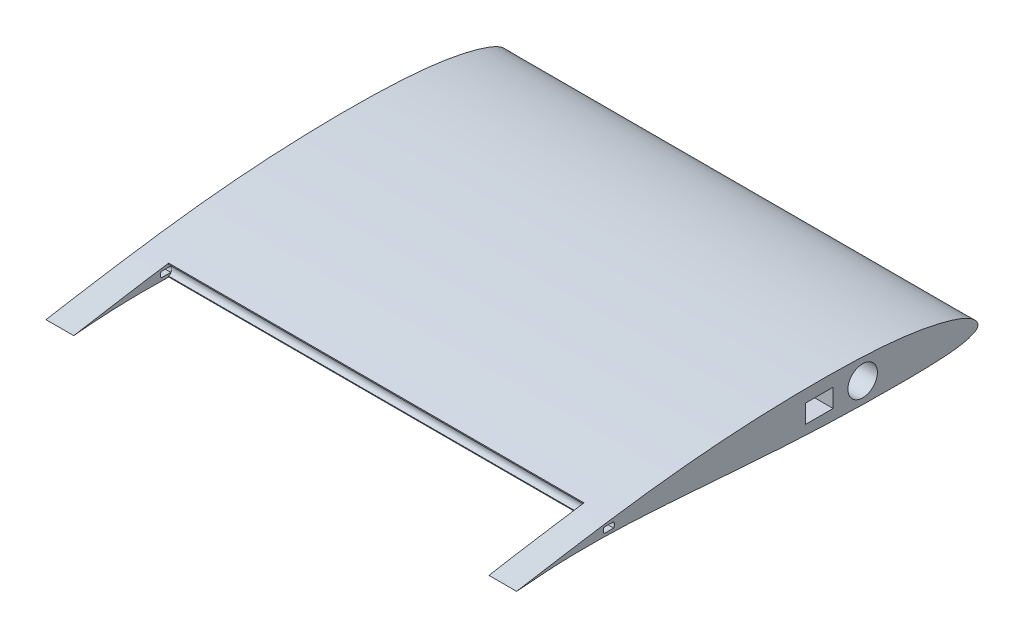
from build123d import *

# Parameters (mm, degrees)
SCHIZZO1_R               = 8
SCHIZZO1_W               = 15
SCHIZZO1_H               = 10
CORPOFOAM_DEPTH          = 225
SCHIZZO2_W               = 5
SCHIZZO2_H               = 6.542892791
SMUSSOPOSTERIORE_DEPTH   = 302.510060719
SCHIZZO3_R               = 8
SCHIZZO3_W               = 15
SCHIZZO3_H               = 10
LATODESTRO_DEPTH         = 15
LATOSINISTRO_START       = 15
SCHIZZO4_R               = 8
SCHIZZO4_W               = 15
SCHIZZO4_H               = 10
LATOSINISTRO_DEPTH       = 15
FOROPERNOALETTONE_DEPTH  = 358.502890584
FOROFOAMLONGHERONE_START = -255
FOROFOAMLONGHERONE_DEPTH = 15


with BuildPart() as part:
    # Schizzo1 → CorpoFoam (new body)
    with BuildSketch(Plane(origin=(0, 0, 0), x_dir=(0, 0, -1), z_dir=(1, 0, 0))):
        with BuildLine():
            ThreePointArc((-200, 8.059305289), (-196.8581753, 4.91748059), (-200, 1.77565589))
            add(Edge.make_bspline(
                [(-200, 1.77565589), (-196.241450344, 1.678792644), (-188.275993902, 1.377404844), (-175.953687417, 0.706014078), (-162.931424918, -0.160208642), (-149.615771744, -1.148016327), (-136.176354995, -2.19092491), (-122.767140548, -3.219583979), (-109.520053587, -4.152743127), (-96.546095975, -4.938564365), (-83.940819302, -5.536830703), (-71.801839291, -5.947648205), (-60.245256003, -6.218450939), (-49.398732891, -6.355369756), (-39.397226194, -6.381387963), (-30.361934842, -6.26504923), (-22.412181103, -6.012164917), (-15.626227231, -5.597433901), (-10.071907511, -4.928706579), (-5.697692612, -4.040446981), (-2.625320639, -2.865752984), (-0.494884225, -1.71152847), (0.021312549, -0.410454231), (-0.0311692, 0.792659827), (-0.812599242, 2.305684337), (-2.728863517, 4.238352424), (-5.769907241, 6.118172121), (-9.880942804, 7.913594202), (-15.074930468, 9.641318178), (-21.298752222, 11.283896488), (-28.49717212, 12.788381759), (-36.607373406, 14.097834908), (-45.57302844, 15.159429017), (-55.332910074, 15.960903998), (-65.816536498, 16.494069738), (-76.93137626, 16.791989705), (-88.566949028, 16.864754131), (-100.596999886, 16.726715291), (-112.888825982, 16.383385064), (-125.311615819, 15.825573667), (-137.743791097, 15.05233187), (-150.072384382, 14.059339074), (-162.191375056, 12.881586986), (-173.989074322, 11.549280346), (-185.352364446, 10.116249729), (-193.973044007, 8.932981988), (-198.793601378, 8.235543811), (-200, 8.059305289)],
                knots=[0.098689812, 0.098689812, 0.098689812, 0.098689812, 0.120926258, 0.145825281, 0.171670912, 0.198108537, 0.224790184, 0.25139058, 0.277643491, 0.30332675, 0.328257458, 0.352272548, 0.375156062, 0.396620664, 0.416422729, 0.43430442, 0.45005468, 0.463465465, 0.474478994, 0.483169222, 0.489678354, 0.494104066, 0.496910015, 0.497289785, 0.501214273, 0.50645795, 0.513356957, 0.522168632, 0.53296597, 0.545689209, 0.560220779, 0.576438923, 0.594258689, 0.613600245, 0.634342386, 0.656331109, 0.679351894, 0.703152303, 0.727478208, 0.752070739, 0.776691164, 0.801140184, 0.825214387, 0.848697424, 0.871352858, 0.892947449, 0.90015767, 0.90015767, 0.90015767, 0.90015767], degree=3))
        make_face()
        with Locations((-62.499919709, 5.077309939)):
            Circle(SCHIZZO1_R, mode=Mode.SUBTRACT)
        with Locations((-85.999919709, 5.077309939)):
            Rectangle(SCHIZZO1_W, SCHIZZO1_H, mode=Mode.SUBTRACT)
    extrude(amount=CORPOFOAM_DEPTH)

    # Schizzo2 → SmussoPosteriore (cut, through all)
    with BuildSketch(Plane(origin=(225, 0, 0), x_dir=(0, 0, -1), z_dir=(1, 0, 0))):
        with Locations((-201, 5.006075261)):
            Rectangle(SCHIZZO2_W, SCHIZZO2_H)
    extrude(amount=-SMUSSOPOSTERIORE_DEPTH, mode=Mode.SUBTRACT)

    # Schizzo3 → LatoDestro (add)
    with BuildSketch(Plane(origin=(225, 0, 0), x_dir=(0, 0, -1), z_dir=(1, 0, 0))):
        with BuildLine():
            add(Edge.make_bspline(
                [(-250, 0), (-250.000228294, -0.008042796), (-248.284955516, 0.172375658), (-246.518112419, 0.308690015), (-242.189387343, 0.685693594), (-236.806461263, 1.074101529), (-229.680385952, 1.49731724), (-221.184158698, 1.823218603), (-211.337618208, 1.967626101), (-200.371188527, 1.833221056), (-188.499913622, 1.38960529), (-175.953687417, 0.706014078), (-162.931424918, -0.160208642), (-149.615771744, -1.148016327), (-136.176354995, -2.19092491), (-122.767140548, -3.219583979), (-109.520053587, -4.152743127), (-96.546095975, -4.938564365), (-83.940819302, -5.536830703), (-71.801839291, -5.947648205), (-60.245256003, -6.218450939), (-49.398732891, -6.355369756), (-39.397226194, -6.381387963), (-30.361934842, -6.26504923), (-22.412181103, -6.012164917), (-15.626227231, -5.597433901), (-10.071907511, -4.928706579), (-5.697692612, -4.040446981), (-2.625320639, -2.865752984), (-0.494884225, -1.71152847), (0.021312549, -0.410454231), (-0.0311692, 0.792659827), (-0.812599242, 2.305684337), (-2.728863517, 4.238352424), (-5.769907241, 6.118172121), (-9.880942804, 7.913594202), (-15.074930468, 9.641318178), (-21.298752222, 11.283896488), (-28.49717212, 12.788381759), (-36.607373406, 14.097834908), (-45.57302844, 15.159429017), (-55.332910074, 15.960903998), (-65.816536498, 16.494069738), (-76.93137626, 16.791989705), (-88.566949028, 16.864754131), (-100.596999886, 16.726715291), (-112.888825982, 16.383385064), (-125.311615819, 15.825573667), (-137.743791097, 15.05233187), (-150.072384382, 14.059339074), (-162.191375056, 12.881586986), (-173.989074322, 11.549280346), (-185.352364446, 10.116249729), (-196.163081698, 8.632379125), (-206.300441402, 7.131513884), (-215.560350587, 5.731221768), (-223.977157043, 4.293295127), (-231.363413336, 3.181808874), (-237.746440904, 2.098942417), (-242.622069366, 1.245861917), (-246.644529332, 0.552864946), (-248.32839844, 0.246216765), (-249.999773563, 0.007977377), (-250, 0)],
                knots=[0, 0, 0, 0, 0.001588889, 0.006329218, 0.014202456, 0.025172808, 0.039173483, 0.056060631, 0.075578924, 0.097363607, 0.120926258, 0.145825281, 0.171670912, 0.198108537, 0.224790184, 0.25139058, 0.277643491, 0.30332675, 0.328257458, 0.352272548, 0.375156062, 0.396620664, 0.416422729, 0.43430442, 0.45005468, 0.463465465, 0.474478994, 0.483169222, 0.489678354, 0.494104066, 0.496910015, 0.497289785, 0.501214273, 0.50645795, 0.513356957, 0.522168632, 0.53296597, 0.545689209, 0.560220779, 0.576438923, 0.594258689, 0.613600245, 0.634342386, 0.656331109, 0.679351894, 0.703152303, 0.727478208, 0.752070739, 0.776691164, 0.801140184, 0.825214387, 0.848697424, 0.871352858, 0.892947449, 0.913230871, 0.931955467, 0.948342069, 0.963693004, 0.976235918, 0.986320059, 0.993788799, 0.998424035, 1, 1, 1, 1], degree=3))
        make_face()
        with Locations((-62.499919709, 5.077309939)):
            Circle(SCHIZZO3_R, mode=Mode.SUBTRACT)
        with Locations((-85.999919709, 5.077309939)):
            Rectangle(SCHIZZO3_W, SCHIZZO3_H, mode=Mode.SUBTRACT)
    extrude(amount=LATODESTRO_DEPTH)

    # Schizzo4 → LatoSinistro (add)
    with BuildSketch(Plane.ZY.offset(LATOSINISTRO_START)):
        with BuildLine():
            add(Edge.make_bspline(
                [(250, 0), (249.999773563, 0.007977377), (248.32839844, 0.246216765), (246.644529332, 0.552864946), (242.622069366, 1.245861917), (237.746440904, 2.098942417), (231.363413336, 3.181808874), (223.977157043, 4.293295127), (215.560350587, 5.731221768), (206.300441402, 7.131513884), (196.163081698, 8.632379125), (185.352364446, 10.116249729), (173.989074322, 11.549280346), (162.191375056, 12.881586986), (150.072384382, 14.059339074), (137.743791097, 15.05233187), (125.311615819, 15.825573667), (112.888825982, 16.383385064), (100.596999886, 16.726715291), (88.566949028, 16.864754131), (76.93137626, 16.791989705), (65.816536498, 16.494069738), (55.332910074, 15.960903998), (45.57302844, 15.159429017), (36.607373406, 14.097834908), (28.49717212, 12.788381759), (21.298752222, 11.283896488), (15.074930468, 9.641318178), (9.880942804, 7.913594202), (5.769907241, 6.118172121), (2.728863517, 4.238352424), (0.812599242, 2.305684337), (0.0311692, 0.792659827), (-0.021312549, -0.410454231), (0.494884225, -1.71152847), (2.625320639, -2.865752984), (5.697692612, -4.040446981), (10.071907511, -4.928706579), (15.626227231, -5.597433901), (22.412181103, -6.012164917), (30.361934842, -6.26504923), (39.397226194, -6.381387963), (49.398732891, -6.355369756), (60.245256003, -6.218450939), (71.801839291, -5.947648205), (83.940819302, -5.536830703), (96.546095975, -4.938564365), (109.520053587, -4.152743127), (122.767140548, -3.219583979), (136.176354995, -2.19092491), (149.615771744, -1.148016327), (162.931424918, -0.160208642), (175.953687417, 0.706014078), (188.499913622, 1.38960529), (200.371188527, 1.833221056), (211.337618208, 1.967626101), (221.184158698, 1.823218603), (229.680385952, 1.49731724), (236.806461263, 1.074101529), (242.189387343, 0.685693594), (246.518112419, 0.308690015), (248.284955516, 0.172375658), (250.000228294, -0.008042796), (250, 0)],
                knots=[0, 0, 0, 0, 0.001575965, 0.006211201, 0.013679941, 0.023764082, 0.036306996, 0.051657931, 0.068044533, 0.086769129, 0.107052551, 0.128647142, 0.151302576, 0.174785613, 0.198859816, 0.223308836, 0.247929261, 0.272521792, 0.296847697, 0.320648106, 0.343668891, 0.365657614, 0.386399755, 0.405741311, 0.423561077, 0.439779221, 0.454310791, 0.46703403, 0.477831368, 0.486643043, 0.49354205, 0.498785727, 0.502710215, 0.503089985, 0.505895934, 0.510321646, 0.516830778, 0.525521006, 0.536534535, 0.54994532, 0.56569558, 0.583577271, 0.603379336, 0.624843938, 0.647727452, 0.671742542, 0.69667325, 0.722356509, 0.74860942, 0.775209816, 0.801891463, 0.828329088, 0.854174719, 0.879073742, 0.902636393, 0.924421076, 0.943939369, 0.960826517, 0.974827192, 0.985797544, 0.993670782, 0.998411111, 1, 1, 1, 1], degree=3))
        make_face()
        with Locations((62.499919709, 5.077309939)):
            Circle(SCHIZZO4_R, mode=Mode.SUBTRACT)
        with Locations((85.999919709, 5.077309939)):
            Rectangle(SCHIZZO4_W, SCHIZZO4_H, mode=Mode.SUBTRACT)
    extrude(amount=-LATOSINISTRO_DEPTH)

    # Schizzo5 → ForoPernoAlettone (cut, through all)
    with BuildSketch(Plane.ZY.offset(15)):
        with BuildLine():
            Line((197.401923789, 6.41748059), (202.598076211, 6.41748059))
            ThreePointArc((202.598076211, 6.41748059), (203, 4.91748059), (202.598076211, 3.41748059))
            Line((202.598076211, 3.41748059), (197.401923789, 3.41748059))
            ThreePointArc((197.401923789, 3.41748059), (197, 4.91748059), (197.401923789, 6.41748059))
        make_face()
    extrude(amount=-FOROPERNOALETTONE_DEPTH, mode=Mode.SUBTRACT)

    # Schizzo6 → ForoFoamLongherone (cut)
    with BuildSketch(Plane(origin=(240, 0, 0), x_dir=(0, 0, -1), z_dir=(1, 0, 0)).offset(FOROFOAMLONGHERONE_START)):
        with BuildLine():
            Line((-68.499919709, 13.077309939), (-56.499919709, 13.077309939))
            ThreePointArc((-56.499919709, 13.077309939), (-52.499919709, 5.077309939), (-56.499919709, -2.922690061))
            Line((-56.499919709, -2.922690061), (-68.499919709, -2.922690061))
            ThreePointArc((-68.499919709, -2.922690061), (-72.499919709, 5.077309939), (-68.499919709, 13.077309939))
        make_face()
    extrude(amount=FOROFOAMLONGHERONE_DEPTH, mode=Mode.SUBTRACT)


solid = part.part
